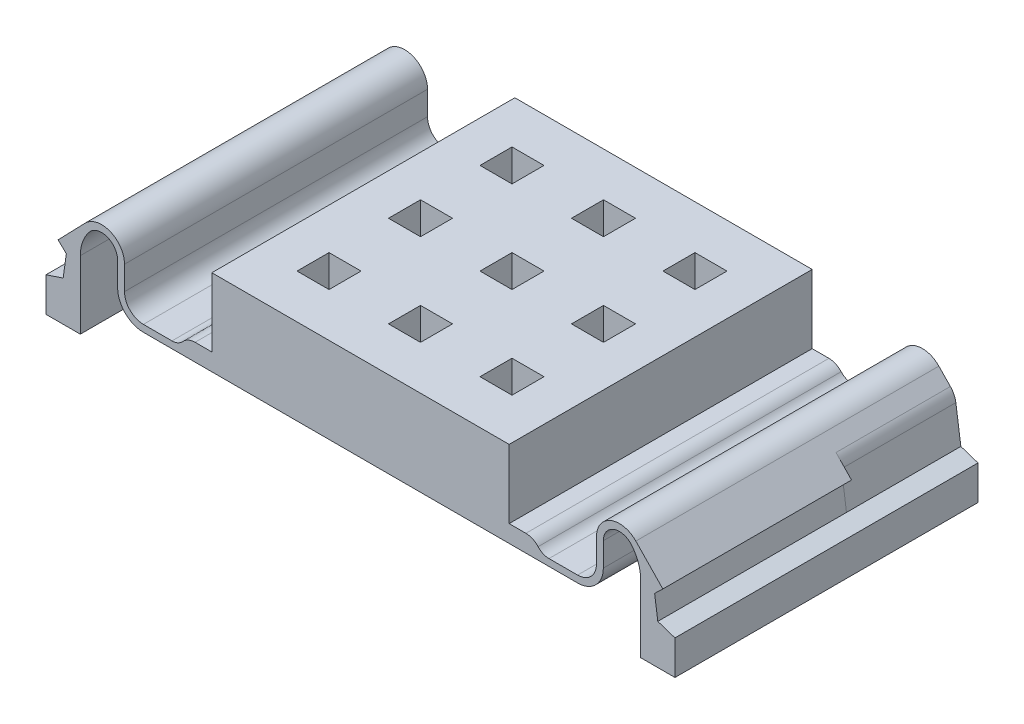
from build123d import *

# Parameters (mm, degrees)
RESSALTO_EXTRUS_O1_DEPTH = 16.5
ESBO_O4_W                = 1.5
ESBO_O4_H                = 16.5
RESSALTO_EXTRUS_O2_DEPTH = 2
RESSALTO_EXTRUS_O3_START = -10
RESSALTO_EXTRUS_O3_DEPTH = 10
ESBO_O5_W                = 26
ESBO_O5_H                = 26.5
RESSALTO_EXTRUS_O4_DEPTH = 6
ESBO_O6_W                = 2.8
ESBO_O6_H                = 2.8
CORTE_EXTRUS_O1_DEPTH    = 33.058488003
RESSALTO_EXTRUS_O5_DEPTH = 26.5


with BuildPart() as part:
    # Esboço3 → Ressalto-extrusão1 (new body)
    with BuildSketch(Plane.XY):
        with BuildLine():
            Line((18.985114218, -0.6), (-18.983112061, -0.6))
            ThreePointArc((-18.983112061, -0.6), (-20.575873515, 0.059743396), (-21.235616911, 1.65250485))
            Line((-21.235616911, 1.65250485), (-21.235616911, 3.729745078))
            ThreePointArc((-21.235616911, 3.729745078), (-22.112654073, 5.030006142), (-23.646779042, 4.703917814))
            ThreePointArc((-23.646779042, 4.703917814), (-24.278856787, 3.652335225), (-24.498998922, 2.44532004))
            Line((-24.498998922, 2.44532004), (-24.498998922, -1.5))
            Line((-24.498998922, -1.5), (-25.998998922, -1.5))
            Line((-25.998998922, -1.5), (-25.998998922, 0))
            Line((-25.998998922, 0), (-25.72065272, 1.980536137))
            Line((-25.72065272, 1.980536137), (-26.43999252, 2.675194508))
            Line((-26.43999252, 2.675194508), (-24.078382922, 5.120712836))
            ThreePointArc((-24.078382922, 5.120712836), (-21.887890117, 5.586316455), (-20.635616911, 3.729745078))
            Line((-20.635616911, 3.729745078), (-20.635616911, 1.65250485))
            ThreePointArc((-20.635616911, 1.65250485), (-20.151609446, 0.484007465), (-18.983112061, 0))
            Line((-18.983112061, 0), (-16.483112061, 0))
            ThreePointArc((-16.483112061, 0), (-15.962423979, 0.111330278), (-15.532789063, 0.425852691))
            ThreePointArc((-15.532789063, 0.425852691), (-15.049887248, 0.77937015), (-14.464643335, 0.904503352))
            Line((-14.464643335, 0.904503352), (-7.266260975, 0.904503352))
            Line((-7.266260975, 0.904503352), (7.268263132, 0.904503352))
            Line((7.268263132, 0.904503352), (14.466645491, 0.904503352))
            ThreePointArc((14.466645491, 0.904503352), (15.051889405, 0.77937015), (15.53479122, 0.425852691))
            ThreePointArc((15.53479122, 0.425852691), (15.964426136, 0.111330278), (16.485114218, 0))
            Line((16.485114218, 0), (18.985114218, 0))
            ThreePointArc((18.985114218, 0), (20.153611603, 0.484007465), (20.637619068, 1.65250485))
            Line((20.637619068, 1.65250485), (20.637619068, 3.729745078))
            ThreePointArc((20.637619068, 3.729745078), (21.889892273, 5.586316455), (24.080385079, 5.120712836))
            Line((24.080385079, 5.120712836), (26.441994677, 2.675194508))
            Line((26.441994677, 2.675194508), (25.722654876, 1.980536137))
            Line((25.722654876, 1.980536137), (26.001001078, 0))
            Line((26.001001078, 0), (26.001001078, -1.5))
            Line((26.001001078, -1.5), (24.501001078, -1.5))
            Line((24.501001078, -1.5), (24.501001078, 2.44532004))
            ThreePointArc((24.501001078, 2.44532004), (24.280858943, 3.652335225), (23.648781199, 4.703917814))
            ThreePointArc((23.648781199, 4.703917814), (22.11465623, 5.030006142), (21.237619068, 3.729745078))
            Line((21.237619068, 3.729745078), (21.237619068, 1.65250485))
            ThreePointArc((21.237619068, 1.65250485), (20.577875672, 0.059743396), (18.985114218, -0.6))
        make_face()
    extrude(amount=RESSALTO_EXTRUS_O1_DEPTH)

    # Esboço4 → Ressalto-extrusão2 (add)
    with BuildSketch(Plane.XZ.offset(1.5)):
        with Locations((25.251001078, 8.25)):
            Rectangle(ESBO_O4_W, ESBO_O4_H)
        with Locations((-25.248998922, 8.25)):
            Rectangle(ESBO_O4_W, ESBO_O4_H)
    extrude(amount=RESSALTO_EXTRUS_O2_DEPTH)

    # Esboço2 → Ressalto-extrusão3 (add)
    with BuildSketch(Plane.XY.offset(RESSALTO_EXTRUS_O3_START)):
        with BuildLine():
            Line((14.466645491, 0.904503352), (-14.464643335, 0.904503352))
            ThreePointArc((-14.464643335, 0.904503352), (-15.049887248, 0.77937015), (-15.532789063, 0.425852691))
            ThreePointArc((-15.532789063, 0.425852691), (-15.962423979, 0.111330278), (-16.483112061, 0))
            Line((-16.483112061, 0), (-18.983112061, 0))
            ThreePointArc((-18.983112061, 0), (-20.151609446, 0.484007465), (-20.635616911, 1.65250485))
            Line((-20.635616911, 1.65250485), (-20.635616911, 3.729745078))
            ThreePointArc((-20.635616911, 3.729745078), (-21.887890117, 5.586316455), (-24.078382922, 5.120712836))
            Line((-24.078382922, 5.120712836), (-25.082936671, 4.080466977))
            ThreePointArc((-25.082936671, 4.080466977), (-25.400658676, 3.626789441), (-25.562720122, 3.09716064))
            Line((-25.562720122, 3.09716064), (-25.998998922, 0))
            Line((-25.998998922, 0), (-25.998998922, -3.5))
            Line((-25.998998922, -3.5), (-24.498998922, -3.5))
            Line((-24.498998922, -3.5), (-24.498998922, 2.44532004))
            ThreePointArc((-24.498998922, 2.44532004), (-24.278856787, 3.652335225), (-23.646779042, 4.703917814))
            ThreePointArc((-23.646779042, 4.703917814), (-22.112654073, 5.030006142), (-21.235616911, 3.729745078))
            Line((-21.235616911, 3.729745078), (-21.235616911, 1.65250485))
            ThreePointArc((-21.235616911, 1.65250485), (-20.575873515, 0.059743396), (-18.983112061, -0.6))
            Line((-18.983112061, -0.6), (18.985114218, -0.6))
            ThreePointArc((18.985114218, -0.6), (20.577875672, 0.059743396), (21.237619068, 1.65250485))
            Line((21.237619068, 1.65250485), (21.237619068, 3.729745078))
            ThreePointArc((21.237619068, 3.729745078), (22.11465623, 5.030006142), (23.648781199, 4.703917814))
            ThreePointArc((23.648781199, 4.703917814), (24.280858943, 3.652335225), (24.501001078, 2.44532004))
            Line((24.501001078, 2.44532004), (24.501001078, -3.5))
            Line((24.501001078, -3.5), (26.001001078, -3.5))
            Line((26.001001078, -3.5), (26.001001078, 0))
            Line((26.001001078, 0), (25.564722279, 3.09716064))
            ThreePointArc((25.564722279, 3.09716064), (25.402660833, 3.626789441), (25.084938828, 4.080466977))
            Line((25.084938828, 4.080466977), (24.080385079, 5.120712836))
            ThreePointArc((24.080385079, 5.120712836), (21.889892273, 5.586316455), (20.637619068, 3.729745078))
            Line((20.637619068, 3.729745078), (20.637619068, 1.65250485))
            ThreePointArc((20.637619068, 1.65250485), (20.153611603, 0.484007465), (18.985114218, 0))
            Line((18.985114218, 0), (16.485114218, 0))
            ThreePointArc((16.485114218, 0), (15.964426136, 0.111330278), (15.53479122, 0.425852691))
            ThreePointArc((15.53479122, 0.425852691), (15.051889405, 0.77937015), (14.466645491, 0.904503352))
        make_face()
    extrude(amount=RESSALTO_EXTRUS_O3_DEPTH)

    # Esboço5 → Ressalto-extrusão4 (add)
    with BuildSketch(Plane(origin=(0, 0.904503352, 0), x_dir=(1, 0, 0), z_dir=(0, 1, 0))):
        with Locations((0.001001078, -3.25)):
            Rectangle(ESBO_O5_W, ESBO_O5_H)
    extrude(amount=RESSALTO_EXTRUS_O4_DEPTH)

    # Esboço6 → Corte-extrusão1 (cut, through all)
    with BuildSketch(Plane.XZ.offset(0.6)):
        with Locations((0.001001078, 11.25)):
            Rectangle(ESBO_O6_W, ESBO_O6_H)
        with Locations((-7.998998922, 11.25)):
            Rectangle(ESBO_O6_W, ESBO_O6_H)
        with Locations((8.001001078, 11.25)):
            Rectangle(ESBO_O6_W, ESBO_O6_H)
        with Locations((0.001001078, 3.25)):
            Rectangle(ESBO_O6_W, ESBO_O6_H)
        with Locations((8.001001078, 3.25)):
            Rectangle(ESBO_O6_W, ESBO_O6_H)
        with Locations((0.001001078, -4.75)):
            Rectangle(ESBO_O6_W, ESBO_O6_H)
        with Locations((8.001001078, -4.75)):
            Rectangle(ESBO_O6_W, ESBO_O6_H)
        with Locations((-7.998998922, 3.25)):
            Rectangle(ESBO_O6_W, ESBO_O6_H)
        with Locations((-7.998998922, -4.75)):
            Rectangle(ESBO_O6_W, ESBO_O6_H)
    extrude(amount=-CORTE_EXTRUS_O1_DEPTH, mode=Mode.SUBTRACT)

    # Esboço8 → Ressalto-extrusão5 (add, through all)
    with BuildSketch(Plane.XY.offset(16.5)):
        Polygon((-25.998998922, -3.5), (-27.498998922, -3.5), (-27.498998922, -0.5), (-25.998998922, 0), align=None)
        Polygon((26.001001078, 0), (26.001001078, -3.5), (27.501001078, -3.5), (27.501001078, -0.5), align=None)
    extrude(amount=-RESSALTO_EXTRUS_O5_DEPTH)


solid = part.part
